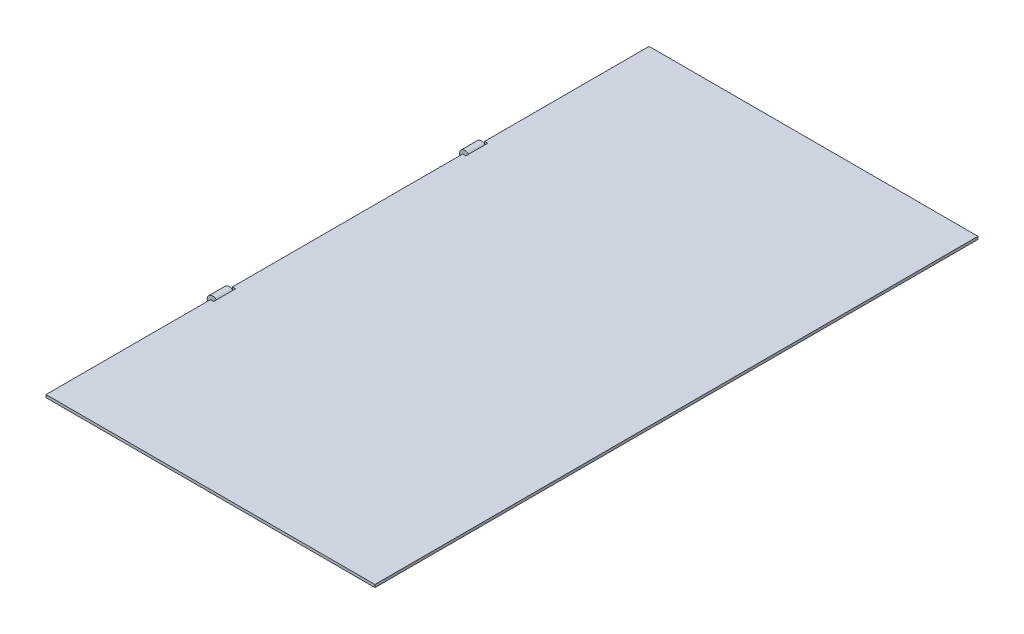
from build123d import *

# Parameters (mm, degrees)
SKETCH1_W               = 300
SKETCH1_H               = 550
BOSS_EXTRUDE1_DEPTH     = 2.5
SKETCH3_R               = 5
SKETCH3_R_2             = 1.245895
BOSS_EXTRUDE2_DEPTH     = 15
SKETCH4_R               = 5
CUT_EXTRUDE1_DEPTH      = 2.5
MIRROR3_COPY_1_SKETCH_R = 5
MIRROR3_COPY_1_DEPTH    = 2.5
MIRROR3_COPY_2_SKETCH_R = 5
MIRROR3_COPY_2_DEPTH    = 2.5


with BuildPart() as part:
    # Sketch1 → Boss-Extrude1 (new body)
    with BuildSketch(Plane(origin=(0, 0, 0), x_dir=(1, 0, 0), z_dir=(0, 1, 0))):
        with Locations((150, 275)):
            Rectangle(SKETCH1_W, SKETCH1_H)
    extrude(amount=BOSS_EXTRUDE1_DEPTH)

    # Sketch3 → Boss-Extrude2 (add)
    with BuildSketch(Plane.XY.offset(-152.5)):
        with Locations((-0.485034728, -1.147604315)):
            Circle(SKETCH3_R)
        with Locations((-0.485034728, -1.147604315)):
            Circle(SKETCH3_R_2, mode=Mode.SUBTRACT)
    boss_extrude2 = extrude(amount=-BOSS_EXTRUDE2_DEPTH)

    # Mirror1: Boss-Extrude2 across plane
    add(boss_extrude2.mirror(Plane.XY.offset(-275)))

    # Sketch4 → Cut-Extrude1 (cut)
    with BuildSketch(Plane.XY.offset(-152.5)):
        with Locations((-0.485034728, -1.147604315)):
            Circle(SKETCH4_R)
    cut_extrude1 = extrude(amount=CUT_EXTRUDE1_DEPTH, mode=Mode.SUBTRACT)

    # Mirror2: Cut-Extrude1 across plane
    add(cut_extrude1.mirror(Plane.XY.offset(-160)), mode=Mode.SUBTRACT)

    # Mirror3 copy 1 sketch → Mirror3 copy 1 (cut)
    with BuildSketch(Plane.XY.offset(-382.5)):
        with Locations((-0.485034728, -1.147604315)):
            Circle(MIRROR3_COPY_1_SKETCH_R)
    extrude(amount=MIRROR3_COPY_1_DEPTH, mode=Mode.SUBTRACT)

    # Mirror3 copy 2 sketch → Mirror3 copy 2 (cut)
    with BuildSketch(Plane(origin=(0, 0, -397.5), x_dir=(1, 0, 0), z_dir=(0, 0, -1))):
        with Locations((-0.485034728, 1.147604315)):
            Circle(MIRROR3_COPY_2_SKETCH_R)
    extrude(amount=MIRROR3_COPY_2_DEPTH, mode=Mode.SUBTRACT)


solid = part.part
